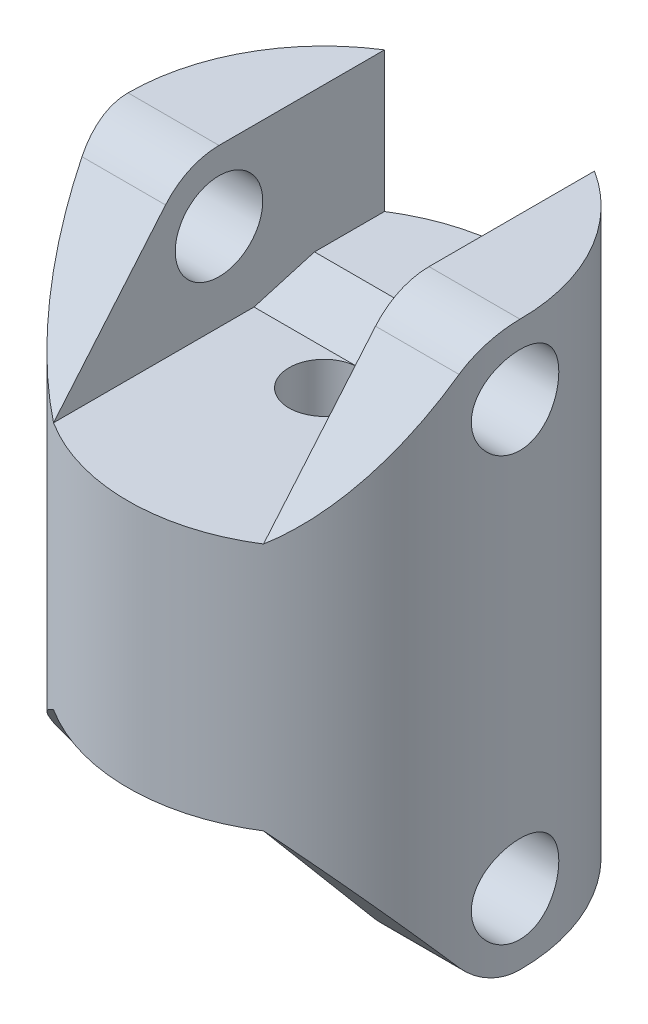
from build123d import *

# Parameters (mm, degrees)
SKETCH1_R               = 14.224
BOSS_EXTRUDE1_DEPTH     = 40.894
CUT_EXTRUDE1_START      = -11.43
CUT_EXTRUDE1_DEPTH      = 11.43
CUT_EXTRUDE2_DEPTH      = 11.43
CUT_EXTRUDE3_DEPTH      = 49.495378625
CUT_EXTRUDE3_DEPTH_BACK = 49.495378625
SKETCH4_R               = 3.175
SKETCH5_R               = 2.54
CUT_EXTRUDE4_DEPTH      = 36.67592549
BOSS_EXTRUDE2_REACH     = 50.495
BOSS_EXTRUDE3_DEPTH     = 1.27


with BuildPart() as part:
    # Sketch1 → Boss-Extrude1 (new body)
    with BuildSketch(Plane(origin=(0, 0, 0), x_dir=(1, 0, 0), z_dir=(0, 1, 0))):
        with Locations(Location((0, 0, 0), (0, 0, 270))):
            Circle(SKETCH1_R)
    extrude(amount=BOSS_EXTRUDE1_DEPTH)

    # Sketch2 → Cut-Extrude1 (cut)
    with BuildSketch(Plane(origin=(0, 40.894, 0), x_dir=(1, 0, 0), z_dir=(0, 1, 0)).offset(CUT_EXTRUDE1_START)):
        with BuildLine():
            Line((7.62, 12.010735864), (7.62, -12.010735864))
            ThreePointArc((7.62, -12.010735864), (0, -14.224), (-7.62, -12.010735864))
            Line((-7.62, -12.010735864), (-7.62, 12.010735864))
            ThreePointArc((-7.62, 12.010735864), (0, 14.224), (7.62, 12.010735864))
        make_face()
    extrude(amount=CUT_EXTRUDE1_DEPTH, mode=Mode.SUBTRACT)

    # Sketch3 → Cut-Extrude2 (cut)
    with BuildSketch(Plane.XZ):
        with BuildLine():
            Line((-7.62, 12.010735864), (-7.62, -12.010735864))
            ThreePointArc((-7.62, -12.010735864), (0, -14.224), (7.62, -12.010735864))
            Line((7.62, -12.010735864), (7.62, 12.010735864))
            ThreePointArc((7.62, 12.010735864), (0, 14.224), (-7.62, 12.010735864))
        make_face()
    extrude(amount=-CUT_EXTRUDE2_DEPTH, mode=Mode.SUBTRACT)

    # Sketch4 → Cut-Extrude3 (cut, two sides: drawn at the far end of the back side and taken through both)
    with BuildSketch(Plane(origin=(-7.62, 0, 0), x_dir=(0, 0, -1), z_dir=(1, 0, 0)).offset(-CUT_EXTRUDE3_DEPTH_BACK)):
        with Locations(Location((0, 35.814, 0), (0, 0, 270))):
            Circle(SKETCH4_R)
        with Locations(Location((0, 5.08, 0), (0, 0, 270))):
            Circle(SKETCH4_R)
        with BuildLine():
            Line((-3.881359545, 39.091414848), (-12.010735864, 29.464))
            Line((-12.010735864, 29.464), (-12.010735864, 40.894))
            Line((-12.010735864, 40.894), (0, 40.894))
            ThreePointArc((0, 40.894), (-2.139758464, 40.42136733), (-3.881359545, 39.091414848))
        make_face()
        with BuildLine():
            Line((-3.881359545, 1.802585152), (-12.010735864, 11.43))
            Line((-12.010735864, 11.43), (-12.010735864, 0))
            Line((-12.010735864, 0), (0, 0))
            ThreePointArc((0, 0), (-2.139758464, 0.47263267), (-3.881359545, 1.802585152))
        make_face()
    extrude(amount=CUT_EXTRUDE3_DEPTH + CUT_EXTRUDE3_DEPTH_BACK, mode=Mode.SUBTRACT)

    # Sketch5 → Cut-Extrude4 (cut, through all)
    with BuildSketch(Plane(origin=(0, 29.464, 0), x_dir=(1, 0, 0), z_dir=(0, 1, 0))):
        with Locations(Location((0, 0, 0), (0, 0, 270))):
            Circle(SKETCH5_R)
    extrude(amount=-CUT_EXTRUDE4_DEPTH, mode=Mode.SUBTRACT)

    # Boss-Extrude2: up to this face of the body (flat: up to its plane)
    boss_extrude2_end = Plane(part.part.faces().sort_by_distance((7.62, 29.730021804, 0))[0])
    # Sketch6 → Boss-Extrude2 (add, up to the picked face)
    with BuildSketch(Plane(origin=(-7.62, 0, 0), x_dir=(0, 0, -1), z_dir=(1, 0, 0)), mode=Mode.PRIVATE) as boss_extrude2_sk1:
        Polygon((2.54, 29.464), (12.010735864, 29.464), (12.010735864, 30.734), (6.930735864, 30.734), align=None)
    boss_extrude2_tool1 = split(extrude(boss_extrude2_sk1.sketch, amount=BOSS_EXTRUDE2_REACH, mode=Mode.PRIVATE), bisect_by=boss_extrude2_end, keep=Keep.BOTH, mode=Mode.PRIVATE)
    add(boss_extrude2_tool1.solids().sort_by(Axis((-7.62, 30.035129, -8.262642), (1, 0, 0)))[0])

    # Sketch7 → Boss-Extrude3 (add)
    with BuildSketch(Plane(origin=(0, 29.464, 0), x_dir=(1, 0, 0), z_dir=(0, 1, 0))):
        with BuildLine():
            Line((-7.62, 12.010735864), (7.62, 12.010735864))
            ThreePointArc((7.62, 12.010735864), (0, 14.224), (-7.62, 12.010735864))
        make_face()
    extrude(amount=BOSS_EXTRUDE3_DEPTH)


solid = part.part
